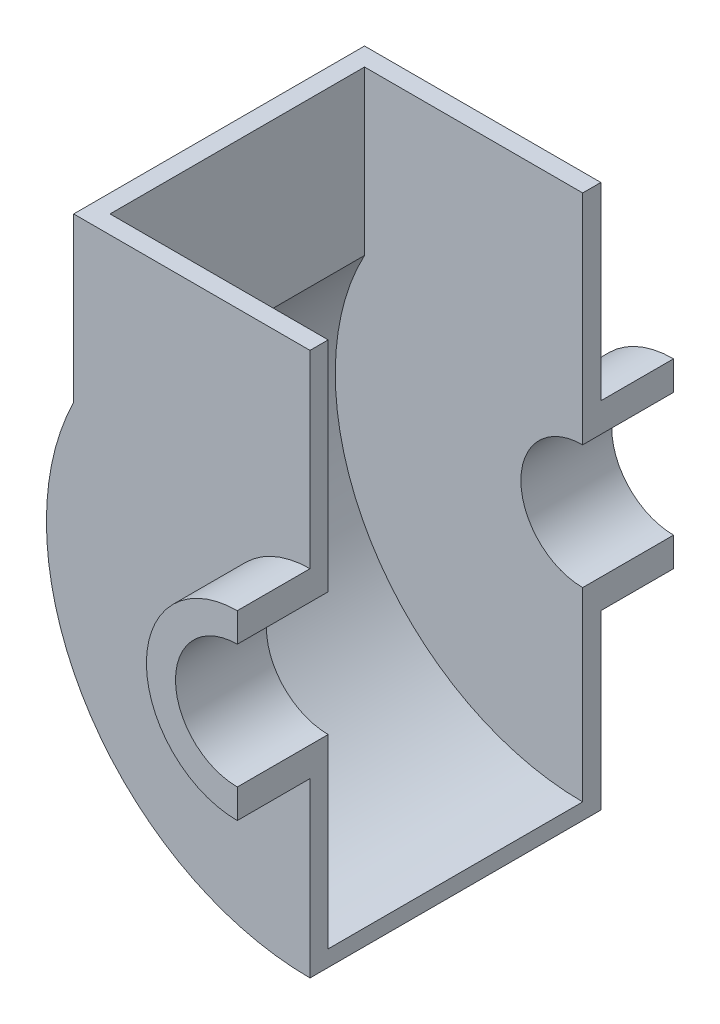
from build123d import *

# Parameters (mm, degrees)
BOSS_EXTRUDE1_DEPTH      = 20
BOSS_EXTRUDE1_DEPTH_BACK = 5
BOSS_EXTRUDE2_START      = -5
BOSS_EXTRUDE2_DEPTH      = 5
BOSS_EXTRUDE3_REACH      = 144.163


with BuildPart() as part:
    # Sketch1 → Boss-Extrude1 (new, two sides: drawn at the far end of the back side and taken through both)
    with BuildSketch(Plane.XY.offset(-BOSS_EXTRUDE1_DEPTH_BACK)):
        with BuildLine():
            Line((0, 25), (0, 17))
            ThreePointArc((0, 17), (-17, 0), (0, -17))
            Line((0, -17), (0, -25))
            ThreePointArc((0, -25), (-25, 0), (0, 25))
        make_face()
    extrude(amount=BOSS_EXTRUDE1_DEPTH + BOSS_EXTRUDE1_DEPTH_BACK)

    # Sketch2 → Boss-Extrude2 (add)
    with BuildSketch(Plane.XY.offset(BOSS_EXTRUDE2_START)):
        with BuildLine():
            ThreePointArc((0, 25), (-25, 0), (0, -25))
            Line((0, -25), (0, -72.5))
            ThreePointArc((0, -72.5), (-61.581037686, -38.262590053), (-65, 32.113081447))
            Line((-65, 32.113081447), (-65, 77))
            Line((-65, 77), (0, 77))
            Line((0, 77), (0, 25))
        make_face()
    extrude(amount=BOSS_EXTRUDE2_DEPTH)


with BuildPart() as body_2:
    # Mirror1: mirrored copy
    add(part.part.mirror(Plane.XY.offset(-40)))

    # Sketch3 → Boss-Extrude3 (add, up to next)
    with BuildSketch(Plane(origin=(0, 0, -5), x_dir=(-1, 0, 0), z_dir=(0, 0, -1)), mode=Mode.PRIVATE) as boss_extrude3_sk1:
        with BuildLine():
            Line((65, 32.113081447), (65, 77))
            Line((65, 77), (60, 77))
            Line((60, 77), (60, 32.113081447))
            ThreePointArc((60, 32.113081447), (58.380864924, -34.970339014), (0, -68.053287944))
            Line((0, -68.053287944), (0, -72.5))
            ThreePointArc((0, -72.5), (61.581037686, -38.262590053), (65, 32.113081447))
        make_face()
    boss_extrude3_tool1 = extrude(boss_extrude3_sk1.sketch, amount=BOSS_EXTRUDE3_REACH, mode=Mode.PRIVATE) - body_2.part

    add(part.part)  # Boss-Extrude3 merges part
    add(boss_extrude3_tool1.solids().sort_by_distance((-63.33848, 54.556541, -5))[0])


solid = body_2.part
